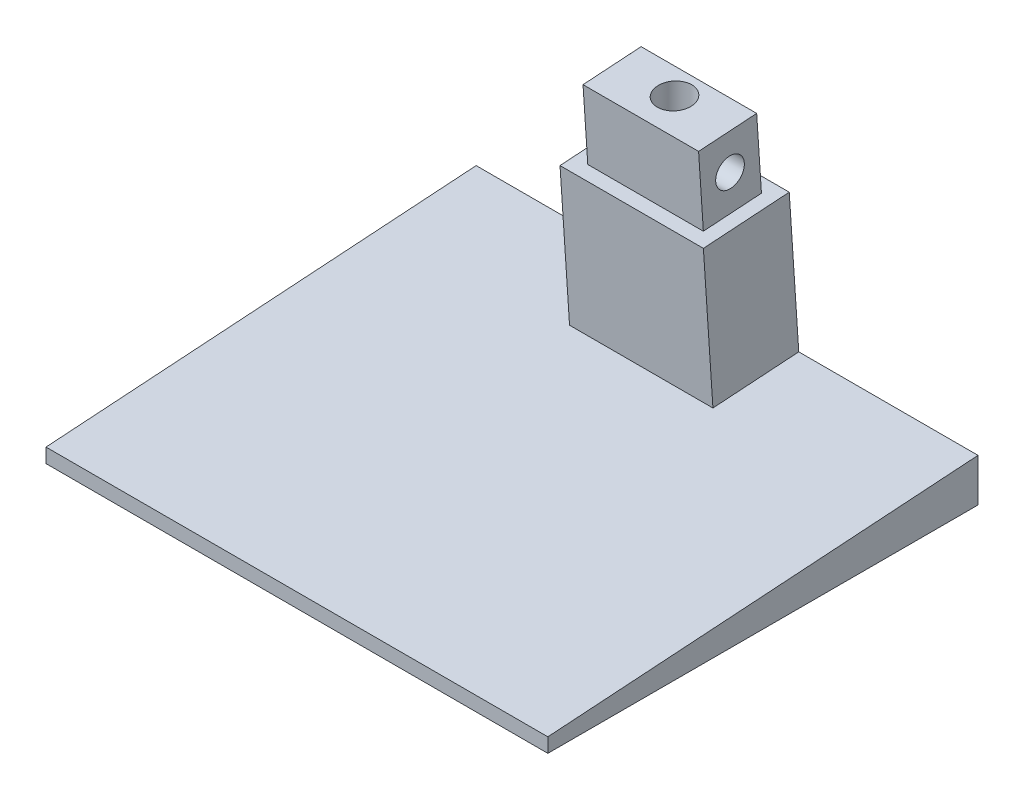
from build123d import *

# Parameters (mm, degrees)
SKETCH1_W           = 175
SKETCH1_H           = 150
BOSS_EXTRUDE1_DEPTH = 15
CUT_EXTRUDE1_DEPTH  = 231.976189249
SKETCH3_W           = 50
SKETCH3_H           = 30
BOSS_EXTRUDE2_DEPTH = 50
SKETCH4_W           = 40.3
SKETCH4_H           = 20.3
BOSS_EXTRUDE3_DEPTH = 25
SKETCH5_R           = 5
CUT_EXTRUDE3_DEPTH  = 206.184770127
SKETCH7_R           = 6
CUT_EXTRUDE5_DEPTH  = 248.25951426
SKETCH8_R           = 12.5
CUT_EXTRUDE6_DEPTH  = 12.5


with BuildPart() as part:
    # Sketch1 → Boss-Extrude1 (new body)
    with BuildSketch(Plane(origin=(0, 0, 0), x_dir=(1, 0, 0), z_dir=(0, 1, 0))):
        with Locations((87.5, 75)):
            Rectangle(SKETCH1_W, SKETCH1_H)
    extrude(amount=BOSS_EXTRUDE1_DEPTH)

    # Sketch2 → Cut-Extrude1 (cut, through all)
    with BuildSketch(Plane(origin=(175, 0, 0), x_dir=(0, 0, -1), z_dir=(1, 0, 0))):
        Polygon((150, 15), (0, 5), (0, 15), align=None)
    extrude(amount=-CUT_EXTRUDE1_DEPTH, mode=Mode.SUBTRACT)

    # Sketch3 → Boss-Extrude2 (add)
    with BuildSketch(Plane(origin=(0, 4.977876106, 0.331858407), x_dir=(1, 0, 0), z_dir=(0, 0.997785157856609, 0.06651901052377394))):
        with Locations((87.5, 135.665558836)):
            Rectangle(SKETCH3_W, SKETCH3_H)
    extrude(amount=BOSS_EXTRUDE2_DEPTH)

    # Sketch4 → Boss-Extrude3 (add)
    with BuildSketch(Plane(origin=(0, 54.867133999, 3.657808933), x_dir=(1, 0, 0), z_dir=(0, 0.997785157856609, 0.0665190105237739))):
        with Locations((87.5, 135.665558836)):
            Rectangle(SKETCH4_W, SKETCH4_H)
    extrude(amount=BOSS_EXTRUDE3_DEPTH)

    # Sketch5 → Cut-Extrude3 (cut, through all)
    with BuildSketch(Plane.ZY.offset(-67.35)):
        with Locations((-130.875784474, 76.363787208)):
            Circle(SKETCH5_R)
    extrude(amount=-CUT_EXTRUDE3_DEPTH, mode=Mode.SUBTRACT)

    # Sketch7 → Cut-Extrude5 (cut, through all)
    with BuildSketch(Plane.XZ):
        with Locations(Location((87.5, -131.674049474, 0), (0, 0, 270))):
            Circle(SKETCH7_R)
    extrude(amount=-CUT_EXTRUDE5_DEPTH, mode=Mode.SUBTRACT)

    # Sketch8 → Cut-Extrude6 (cut)
    with BuildSketch(Plane.XZ):
        with Locations(Location((87.5, -131.674049474, 0), (0, 0, 270))):
            Circle(SKETCH8_R)
    extrude(amount=-CUT_EXTRUDE6_DEPTH, mode=Mode.SUBTRACT)


solid = part.part
